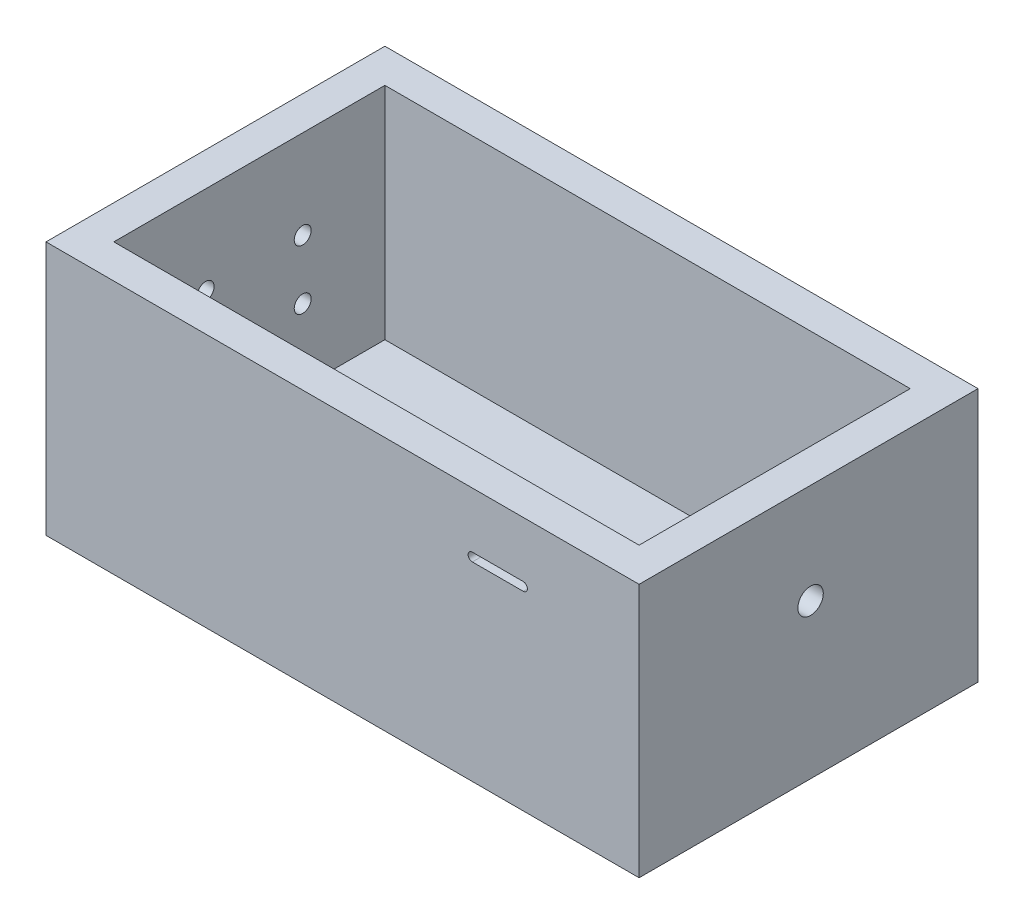
from build123d import *

# Parameters (mm, degrees)
SKETCH_2_W          = 350
SKETCH_2_H          = 200
EXTRUDE_1_DEPTH     = 150
SHELL_1_T           = -20
CUT_EXTRUDE_1_REACH = 426.016
SKETCH_3_R          = 5
CUT_EXTRUDE_2_REACH = 426.016
SKETCH_4_R          = 7.5
CUT_EXTRUDE_3_REACH = 424.637


with BuildPart() as part:
    # 草图2 → 凸台-拉伸1 (new body)
    with BuildSketch(Plane(origin=(0, 0, 0), x_dir=(1, 0, 0), z_dir=(0, 1, 0))):
        with Locations((165.766338514, -86.518854231)):
            Rectangle(SKETCH_2_W, SKETCH_2_H)
    extrude(amount=EXTRUDE_1_DEPTH)

    # 抽壳1
    shell_1_openings = [part.faces().sort_by_distance(p)[0] for p in [
        (165.766338514, 150, 86.518854231),
    ]]
    offset(amount=SHELL_1_T, openings=shell_1_openings, kind=Kind.INTERSECTION)

    # 草图3 → 切除-拉伸1 (cut, up to next)
    with BuildSketch(Plane.ZY.offset(9.233661486), mode=Mode.PRIVATE) as cut_extrude_1_sk1:
        with Locations((55.039711013, 97.66717145)):
            Circle(SKETCH_3_R)
    cut_extrude_1_tool1 = extrude(cut_extrude_1_sk1.sketch, amount=-CUT_EXTRUDE_1_REACH, mode=Mode.PRIVATE) & part.part
    # 草图3 → 切除-拉伸1 (cut, up to next)
    with BuildSketch(Plane.ZY.offset(9.233661486), mode=Mode.PRIVATE) as cut_extrude_1_sk2:
        with Locations((112.314263257, 97.66717145)):
            Circle(SKETCH_3_R)
    cut_extrude_1_tool2 = extrude(cut_extrude_1_sk2.sketch, amount=-CUT_EXTRUDE_1_REACH, mode=Mode.PRIVATE) & part.part
    # 草图3 → 切除-拉伸1 (cut, up to next)
    with BuildSketch(Plane.ZY.offset(9.233661486), mode=Mode.PRIVATE) as cut_extrude_1_sk3:
        with Locations((55.039711013, 62.690345652)):
            Circle(SKETCH_3_R)
    cut_extrude_1_tool3 = extrude(cut_extrude_1_sk3.sketch, amount=-CUT_EXTRUDE_1_REACH, mode=Mode.PRIVATE) & part.part
    # 草图3 → 切除-拉伸1 (cut, up to next)
    with BuildSketch(Plane.ZY.offset(9.233661486), mode=Mode.PRIVATE) as cut_extrude_1_sk4:
        with Locations((112.314263257, 62.690345652)):
            Circle(SKETCH_3_R)
    cut_extrude_1_tool4 = extrude(cut_extrude_1_sk4.sketch, amount=-CUT_EXTRUDE_1_REACH, mode=Mode.PRIVATE) & part.part
    add(cut_extrude_1_tool1.solids().sort_by_distance((-9.233661, 97.667171, 55.039711))[0], mode=Mode.SUBTRACT)
    add(cut_extrude_1_tool2.solids().sort_by_distance((-9.233661, 97.667171, 112.314263))[0], mode=Mode.SUBTRACT)
    add(cut_extrude_1_tool3.solids().sort_by_distance((-9.233661, 62.690346, 55.039711))[0], mode=Mode.SUBTRACT)
    add(cut_extrude_1_tool4.solids().sort_by_distance((-9.233661, 62.690346, 112.314263))[0], mode=Mode.SUBTRACT)

    # 草图4 → 切除-拉伸2 (cut, up to next)
    with BuildSketch(Plane(origin=(340.766338514, 0, 0), x_dir=(0, 0, -1), z_dir=(1, 0, 0)), mode=Mode.PRIVATE) as cut_extrude_2_sk1:
        with Locations((-85.318851387, 90.981577925)):
            Circle(SKETCH_4_R)
    cut_extrude_2_tool1 = extrude(cut_extrude_2_sk1.sketch, amount=-CUT_EXTRUDE_2_REACH, mode=Mode.PRIVATE) & part.part
    add(cut_extrude_2_tool1.solids().sort_by_distance((340.766339, 90.981578, 85.318851))[0], mode=Mode.SUBTRACT)

    # 草图5 → 切除-拉伸3 (cut, up to next)
    with BuildSketch(Plane.XY.offset(186.518854231), mode=Mode.PRIVATE) as cut_extrude_3_sk1:
        with BuildLine():
            Line((242.364675661, 117.233767731), (272.364675661, 117.233767731))
            ThreePointArc((272.364675661, 117.233767731), (274.864675661, 114.733767731), (272.364675661, 112.233767731))
            Line((272.364675661, 112.233767731), (242.364675661, 112.233767731))
            ThreePointArc((242.364675661, 112.233767731), (239.864675661, 114.733767731), (242.364675661, 117.233767731))
        make_face()
    cut_extrude_3_tool1 = extrude(cut_extrude_3_sk1.sketch, amount=-CUT_EXTRUDE_3_REACH, mode=Mode.PRIVATE) & part.part
    add(cut_extrude_3_tool1.solids().sort_by_distance((257.364676, 114.733768, 186.518854))[0], mode=Mode.SUBTRACT)


solid = part.part
